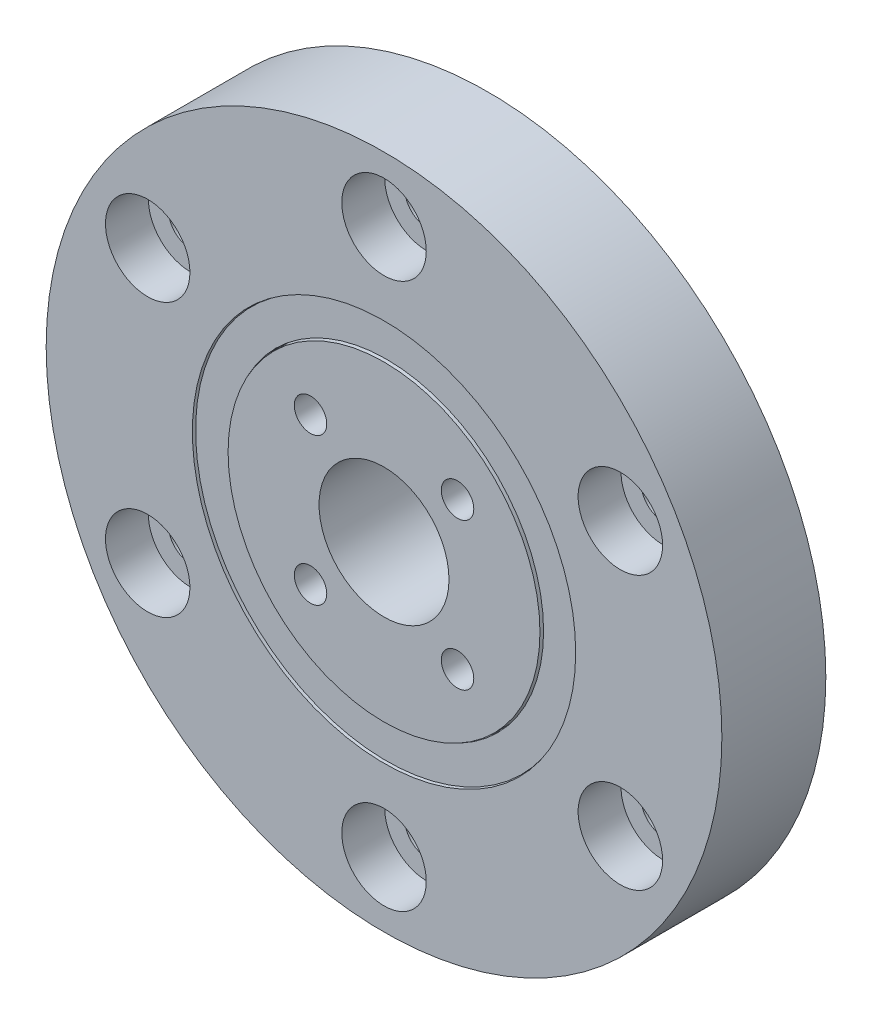
from build123d import *

# Parameters (mm, degrees)
D52_D29_5_8_2_R                    = 26
D52_D29_5_8_2_R_2                  = 14.75
D52_D29_5_8_DEPTH                  = 8
D10_D24_8_2_R                      = 12
D10_D24_8_2_R_2                    = 5
D10_D24_8_DEPTH                    = 8
F_6XD3_4_D6_5_3_3_PCD42_AT_2_COUNT = 2
F_6XD3_4_D6_5_3_3_PCD42_AT_2_PITCH = 21
F_6XD3_4_D6_5_3_3_PCD42_AT_3_COUNT = 2
F_6XD3_4_D6_5_3_3_PCD42_AT_3_PITCH = 36.373066959
F_6XD3_4_D6_5_3_3_PCD42_AT_4_COUNT = 2
F_6XD3_4_D6_5_3_3_PCD42_AT_4_PITCH = 42
F_6XD3_4_D6_5_3_3_PCD42_AT_5_COUNT = 2
F_6XD3_4_D6_5_3_3_PCD42_AT_5_PITCH = 36.373066959
F_6XD3_4_D6_5_3_3_PCD42_AT_6_COUNT = 2
F_6XD3_4_D6_5_3_3_PCD42_AT_6_PITCH = 21
SKETCH_6_W                         = 1.25
SKETCH_6_H                         = 8
F_4XM3X0_5_PCD16_AT_2_COUNT        = 2
F_4XM3X0_5_PCD16_AT_2_PITCH        = 11.313708499
F_4XM3X0_5_PCD16_AT_3_COUNT        = 2
F_4XM3X0_5_PCD16_AT_3_PITCH        = 16
F_4XM3X0_5_PCD16_AT_4_COUNT        = 2
F_4XM3X0_5_PCD16_AT_4_PITCH        = 11.313708499
EXTRUDE_START                      = 7.25
SKETCH_2073_R                      = 14.7
SKETCH_2073_R_2                    = 12.08
EXTRUDE_2084_DEPTH                 = 0.55
EXTRUDE_START_2                    = 0.2
SKETCH_2121_R                      = 14.7
SKETCH_2121_R_2                    = 12.08
EXTRUDE_2132_DEPTH                 = 0.55


with BuildPart() as part:
    # D52__D29.5__8 2 → D52__D29.5__8 (new body)
    with BuildSketch(Plane.XY):
        Circle(D52_D29_5_8_2_R)
        Circle(D52_D29_5_8_2_R_2, mode=Mode.SUBTRACT)
    extrude(amount=D52_D29_5_8_DEPTH)

    # 草图4 → 外圈_6xD3.4通孔_D6.5沉孔深3.3_PCD42 (revolve, cut)
    with BuildSketch(Plane(origin=(18.186533479, 10.5, 8), x_dir=(0, -1, 0), z_dir=(1, 0, 0))):
        Polygon((0, 0), (0, 8), (1.7, 8), (1.7, 3.3), (3.25, 3.3), (3.25, 0), align=None)
    f_6xd3_4_d6_5_3_3_pcd42 = revolve(axis=Axis((18.186533479, 10.5, 14.35), (0, 0, -1)), mode=Mode.SUBTRACT)

    # 外圈_6xD3.4通孔_D6.5沉孔深3.3_PCD42 at 2: 外圈_6xD3.4通孔_D6.5沉孔深3.3_PCD42 ×2
    with Locations(*[(0, -i * F_6XD3_4_D6_5_3_3_PCD42_AT_2_PITCH, 0) for i in range(1, F_6XD3_4_D6_5_3_3_PCD42_AT_2_COUNT)]):
        add(f_6xd3_4_d6_5_3_3_pcd42, mode=Mode.SUBTRACT)

    # 外圈_6xD3.4通孔_D6.5沉孔深3.3_PCD42 at 3: 外圈_6xD3.4通孔_D6.5沉孔深3.3_PCD42 ×2
    with Locations(*[Vector(-0.5000000000000001, -0.8660254037844386, 0) * (i * F_6XD3_4_D6_5_3_3_PCD42_AT_3_PITCH) for i in range(1, F_6XD3_4_D6_5_3_3_PCD42_AT_3_COUNT)]):
        add(f_6xd3_4_d6_5_3_3_pcd42, mode=Mode.SUBTRACT)

    # 外圈_6xD3.4通孔_D6.5沉孔深3.3_PCD42 at 4: 外圈_6xD3.4通孔_D6.5沉孔深3.3_PCD42 ×2
    with Locations(*[Vector(-0.8660254037844387, -0.49999999999999983, 0) * (i * F_6XD3_4_D6_5_3_3_PCD42_AT_4_PITCH) for i in range(1, F_6XD3_4_D6_5_3_3_PCD42_AT_4_COUNT)]):
        add(f_6xd3_4_d6_5_3_3_pcd42, mode=Mode.SUBTRACT)

    # 外圈_6xD3.4通孔_D6.5沉孔深3.3_PCD42 at 5: 外圈_6xD3.4通孔_D6.5沉孔深3.3_PCD42 ×2
    with Locations(*[(-i * F_6XD3_4_D6_5_3_3_PCD42_AT_5_PITCH, 0, 0) for i in range(1, F_6XD3_4_D6_5_3_3_PCD42_AT_5_COUNT)]):
        add(f_6xd3_4_d6_5_3_3_pcd42, mode=Mode.SUBTRACT)

    # 外圈_6xD3.4通孔_D6.5沉孔深3.3_PCD42 at 6: 外圈_6xD3.4通孔_D6.5沉孔深3.3_PCD42 ×2
    with Locations(*[Vector(-0.8660254037844387, 0.5, 0) * (i * F_6XD3_4_D6_5_3_3_PCD42_AT_6_PITCH) for i in range(1, F_6XD3_4_D6_5_3_3_PCD42_AT_6_COUNT)]):
        add(f_6xd3_4_d6_5_3_3_pcd42, mode=Mode.SUBTRACT)


with BuildPart() as body_2:
    # D10__D24__8 2 → D10__D24__8 (new body)
    with BuildSketch(Plane.XY):
        Circle(D10_D24_8_2_R)
        Circle(D10_D24_8_2_R_2, mode=Mode.SUBTRACT)
    extrude(amount=D10_D24_8_DEPTH)

    # 草图6 → 内圈_4xM3x0.5通螺纹_PCD16 (revolve, cut)
    with BuildSketch(Plane(origin=(5.656854249, -5.656854249, 8), x_dir=(0, -1, 0), z_dir=(1, 0, 0))):
        with Locations((0.625, 4)):
            Rectangle(SKETCH_6_W, SKETCH_6_H)
    f_4xm3x0_5_pcd16 = revolve(axis=Axis((5.656854249, -5.656854249, 14.35), (0, 0, -1)), mode=Mode.SUBTRACT)

    # 内圈_4xM3x0.5通螺纹_PCD16 at 2: 内圈_4xM3x0.5通螺纹_PCD16 ×2
    with Locations(*[(-i * F_4XM3X0_5_PCD16_AT_2_PITCH, 0, 0) for i in range(1, F_4XM3X0_5_PCD16_AT_2_COUNT)]):
        add(f_4xm3x0_5_pcd16, mode=Mode.SUBTRACT)

    # 内圈_4xM3x0.5通螺纹_PCD16 at 3: 内圈_4xM3x0.5通螺纹_PCD16 ×2
    with Locations(*[Vector(-0.7071067811865475, 0.7071067811865477, 0) * (i * F_4XM3X0_5_PCD16_AT_3_PITCH) for i in range(1, F_4XM3X0_5_PCD16_AT_3_COUNT)]):
        add(f_4xm3x0_5_pcd16, mode=Mode.SUBTRACT)

    # 内圈_4xM3x0.5通螺纹_PCD16 at 4: 内圈_4xM3x0.5通螺纹_PCD16 ×2
    with Locations(*[(0, i * F_4XM3X0_5_PCD16_AT_4_PITCH, 0) for i in range(1, F_4XM3X0_5_PCD16_AT_4_COUNT)]):
        add(f_4xm3x0_5_pcd16, mode=Mode.SUBTRACT)


with BuildPart() as body_3:
    # Sketch 2073 → Extrude 2084 (new body)
    with BuildSketch(Plane.XY.offset(EXTRUDE_START)):
        Circle(SKETCH_2073_R)
        Circle(SKETCH_2073_R_2, mode=Mode.SUBTRACT)
    extrude(amount=EXTRUDE_2084_DEPTH)


with BuildPart() as body_4:
    # Sketch 2121 → Extrude 2132 (new body)
    with BuildSketch(Plane.XY.offset(EXTRUDE_START_2)):
        Circle(SKETCH_2121_R)
        Circle(SKETCH_2121_R_2, mode=Mode.SUBTRACT)
    extrude(amount=EXTRUDE_2132_DEPTH)


solid = Compound([part.part, body_2.part, body_3.part, body_4.part])
